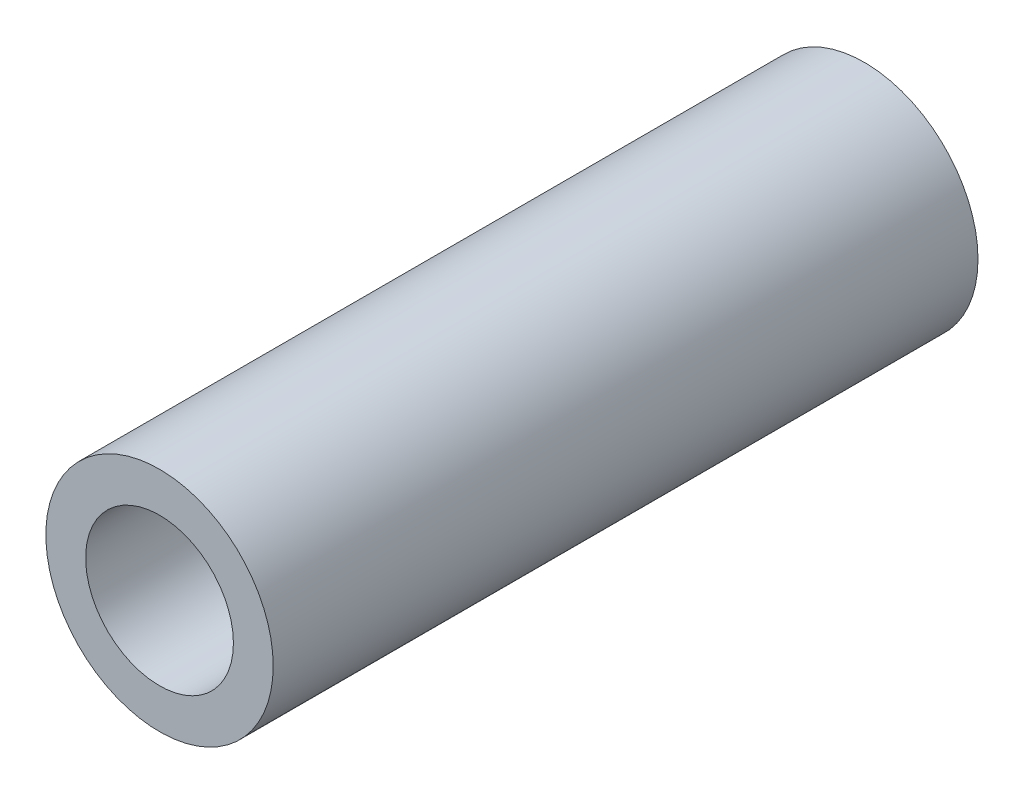
from build123d import *

# Parameters (mm, degrees)
ESQUISSE1_R        = 10
ESQUISSE1_R_2      = 6.5
BOSS_EXTRU_1_DEPTH = 62


with BuildPart() as part:
    # Esquisse1 → Boss.-Extru.1 (new body)
    with BuildSketch(Plane.XY):
        Circle(ESQUISSE1_R)
        Circle(ESQUISSE1_R_2, mode=Mode.SUBTRACT)
    extrude(amount=BOSS_EXTRU_1_DEPTH)


solid = part.part
